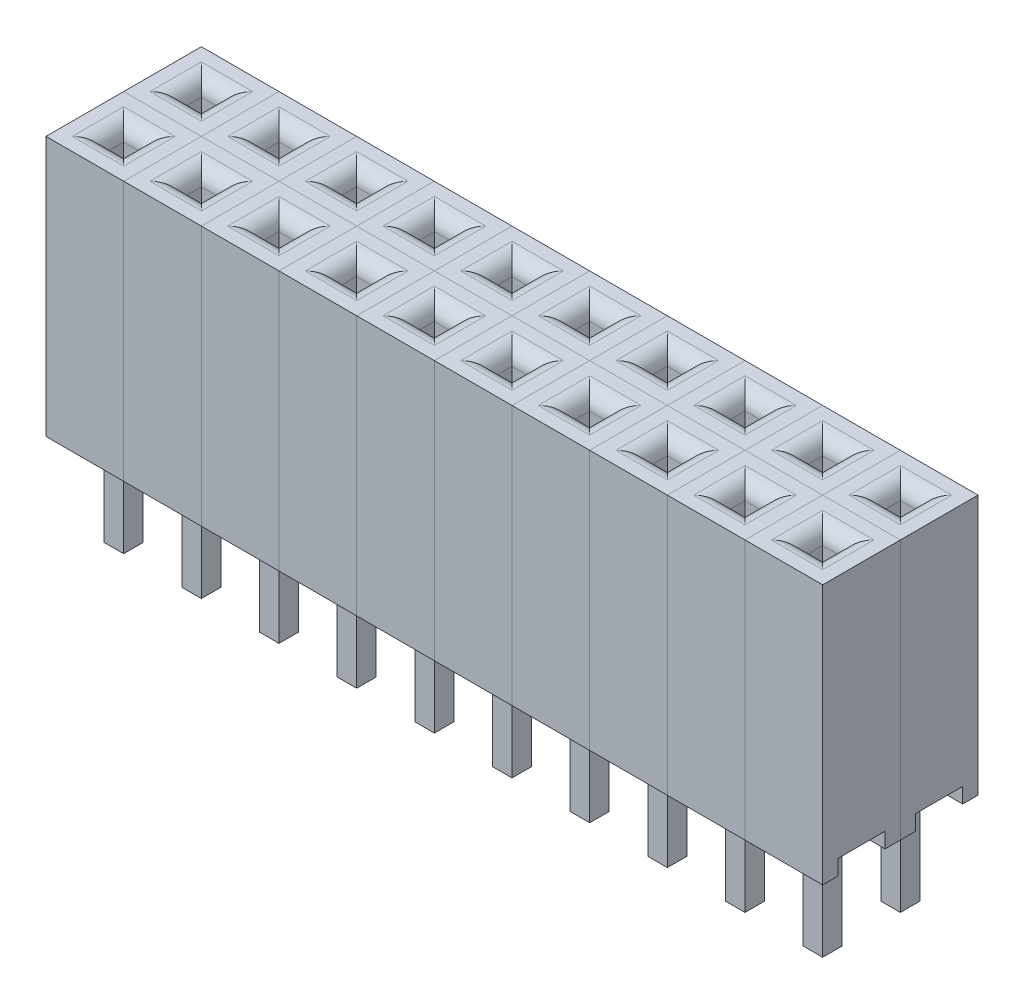
from build123d import *

# Parameters (mm, degrees)
SKETCH_1_W               = 2.54
SKETCH_1_H               = 2.54
EXTRUDE_1_DEPTH          = 8.5
CUT_EXTRUDE_2_DEPTH      = 9.687680933
CUT_EXTRUDE_2_DEPTH_BACK = 9.687680933
SKETCH_3_W               = 1.54
SKETCH_3_H               = 0.5
SKETCH_2_W               = 0.68
SKETCH_2_H               = 0.68
CUT_EXTRUDE_1_DEPTH      = 7
EXTRUDE_2_DEPTH          = 0.32
FILLET_1_R               = 0.5
PATTERN_LINEAR_1_COUNT   = 10
PATTERN_LINEAR_1_PITCH   = 2.54
PATTERN_LINEAR_1_2_COUNT = 2
PATTERN_LINEAR_1_2_PITCH = 2.54


with BuildPart() as part:
    # 草图1 → 凸台-拉伸1 (new body)
    with BuildSketch(Plane(origin=(0, 0, 0), x_dir=(1, 0, 0), z_dir=(0, 1, 0))):
        Rectangle(SKETCH_1_W, SKETCH_1_H)
    extrude(amount=EXTRUDE_1_DEPTH)

    # 草图3 → 切除-拉伸2 (cut, two sides: drawn at the far end of the back side and taken through both)
    with BuildSketch(Plane(origin=(0, 0, 0), x_dir=(0, 0, -1), z_dir=(1, 0, 0)).offset(-CUT_EXTRUDE_2_DEPTH_BACK)):
        with Locations((0, 0.25)):
            Rectangle(SKETCH_3_W, SKETCH_3_H)
    extrude(amount=CUT_EXTRUDE_2_DEPTH + CUT_EXTRUDE_2_DEPTH_BACK, mode=Mode.SUBTRACT)

    # 草图2 → 切除-拉伸1 (cut)
    with BuildSketch(Plane(origin=(0, 8.5, 0), x_dir=(1, 0, 0), z_dir=(0, 1, 0))):
        Rectangle(SKETCH_2_W, SKETCH_2_H)
    extrude(amount=-CUT_EXTRUDE_1_DEPTH, mode=Mode.SUBTRACT)

    # 草图4 → 凸台-拉伸2 (add, symmetric)
    with BuildSketch(Plane(origin=(0, 0, 0), x_dir=(0, 0, -1), z_dir=(1, 0, 0))):
        Polygon((-0.13, 0.642517605), (0.32, 0.342517605), (0.32, -3), (-0.32, -3), (-0.32, 0), (-0.77, 0.3), (-0.77, 0.5), (-0.13, 0.5), align=None)
    extrude(amount=EXTRUDE_2_DEPTH, both=True)

    # 圆角1
    fillet_1_edges = [part.edges().sort_by_distance(p)[0] for p in [
        (0.34, 8.5, 0),
        (0, 8.5, -0.34),
        (-0.34, 8.5, 0),
        (0, 8.5, 0.34),
    ]]
    fillet(fillet_1_edges, radius=FILLET_1_R)


with BuildPart() as pattern_linear_1_1:
    # 阵列(线性)1: pattern copy
    add(part.part.moved(Location(Vector(1, 0, 0) * (1 * PATTERN_LINEAR_1_PITCH))))


with BuildPart() as pattern_linear_1_2:
    # 阵列(线性)1: pattern copy
    add(part.part.moved(Location(Vector(1, 0, 0) * (2 * PATTERN_LINEAR_1_PITCH))))


with BuildPart() as pattern_linear_1_3:
    # 阵列(线性)1: pattern copy
    add(part.part.moved(Location(Vector(1, 0, 0) * (3 * PATTERN_LINEAR_1_PITCH))))


with BuildPart() as pattern_linear_1_4:
    # 阵列(线性)1: pattern copy
    add(part.part.moved(Location(Vector(1, 0, 0) * (4 * PATTERN_LINEAR_1_PITCH))))


with BuildPart() as pattern_linear_1_5:
    # 阵列(线性)1: pattern copy
    add(part.part.moved(Location(Vector(1, 0, 0) * (5 * PATTERN_LINEAR_1_PITCH))))


with BuildPart() as pattern_linear_1_6:
    # 阵列(线性)1: pattern copy
    add(part.part.moved(Location(Vector(1, 0, 0) * (6 * PATTERN_LINEAR_1_PITCH))))


with BuildPart() as pattern_linear_1_7:
    # 阵列(线性)1: pattern copy
    add(part.part.moved(Location(Vector(1, 0, 0) * (7 * PATTERN_LINEAR_1_PITCH))))


with BuildPart() as pattern_linear_1_8:
    # 阵列(线性)1: pattern copy
    add(part.part.moved(Location(Vector(1, 0, 0) * (8 * PATTERN_LINEAR_1_PITCH))))


with BuildPart() as pattern_linear_1_9:
    # 阵列(线性)1: pattern copy
    add(part.part.moved(Location(Vector(1, 0, 0) * (9 * PATTERN_LINEAR_1_PITCH))))


with BuildPart() as pattern_linear_1_2_1:
    # Pattern Linear 1 2: pattern copy
    add(part.part.moved(Location(Vector(0, 0, 1) * (1 * PATTERN_LINEAR_1_2_PITCH))))


with BuildPart() as pattern_linear_1_2_2:
    # Pattern Linear 1 2: pattern copy
    add(pattern_linear_1_1.part.moved(Location(Vector(0, 0, 1) * (1 * PATTERN_LINEAR_1_2_PITCH))))


with BuildPart() as pattern_linear_1_2_3:
    # Pattern Linear 1 2: pattern copy
    add(pattern_linear_1_2.part.moved(Location(Vector(0, 0, 1) * (1 * PATTERN_LINEAR_1_2_PITCH))))


with BuildPart() as pattern_linear_1_2_4:
    # Pattern Linear 1 2: pattern copy
    add(pattern_linear_1_3.part.moved(Location(Vector(0, 0, 1) * (1 * PATTERN_LINEAR_1_2_PITCH))))


with BuildPart() as pattern_linear_1_2_5:
    # Pattern Linear 1 2: pattern copy
    add(pattern_linear_1_4.part.moved(Location(Vector(0, 0, 1) * (1 * PATTERN_LINEAR_1_2_PITCH))))


with BuildPart() as pattern_linear_1_2_6:
    # Pattern Linear 1 2: pattern copy
    add(pattern_linear_1_5.part.moved(Location(Vector(0, 0, 1) * (1 * PATTERN_LINEAR_1_2_PITCH))))


with BuildPart() as pattern_linear_1_2_7:
    # Pattern Linear 1 2: pattern copy
    add(pattern_linear_1_6.part.moved(Location(Vector(0, 0, 1) * (1 * PATTERN_LINEAR_1_2_PITCH))))


with BuildPart() as pattern_linear_1_2_8:
    # Pattern Linear 1 2: pattern copy
    add(pattern_linear_1_7.part.moved(Location(Vector(0, 0, 1) * (1 * PATTERN_LINEAR_1_2_PITCH))))


with BuildPart() as pattern_linear_1_2_9:
    # Pattern Linear 1 2: pattern copy
    add(pattern_linear_1_8.part.moved(Location(Vector(0, 0, 1) * (1 * PATTERN_LINEAR_1_2_PITCH))))


with BuildPart() as pattern_linear_1_2_10:
    # Pattern Linear 1 2: pattern copy
    add(pattern_linear_1_9.part.moved(Location(Vector(0, 0, 1) * (1 * PATTERN_LINEAR_1_2_PITCH))))


solid = Compound([part.part, pattern_linear_1_1.part, pattern_linear_1_2.part, pattern_linear_1_3.part, pattern_linear_1_4.part, pattern_linear_1_5.part, pattern_linear_1_6.part, pattern_linear_1_7.part, pattern_linear_1_8.part, pattern_linear_1_9.part, pattern_linear_1_2_1.part, pattern_linear_1_2_2.part, pattern_linear_1_2_3.part, pattern_linear_1_2_4.part, pattern_linear_1_2_5.part, pattern_linear_1_2_6.part, pattern_linear_1_2_7.part, pattern_linear_1_2_8.part, pattern_linear_1_2_9.part, pattern_linear_1_2_10.part])
